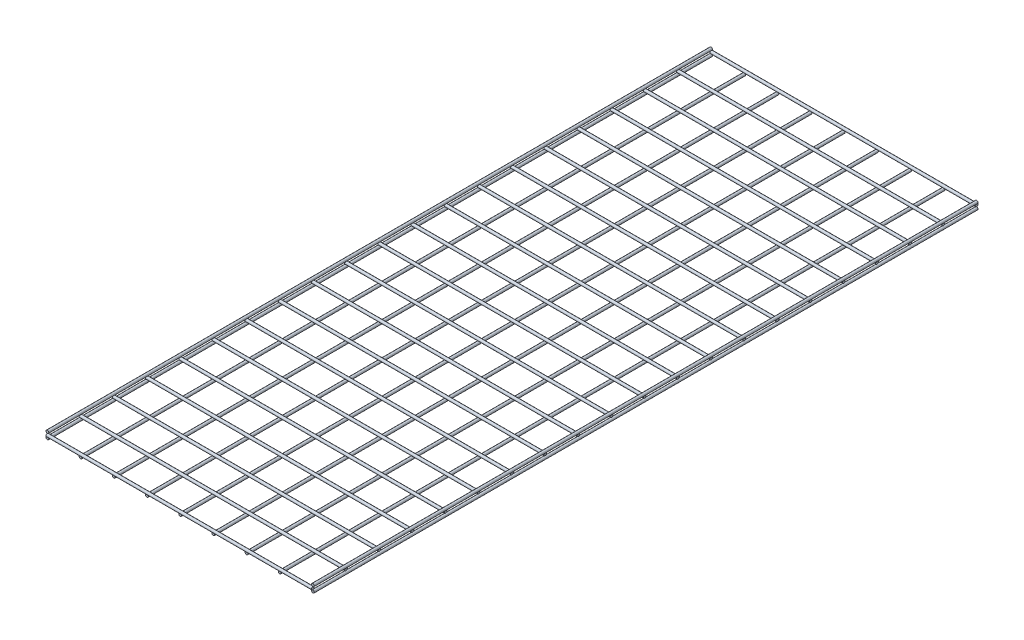
from build123d import *

# Parameters (mm, degrees)
SKETCH1_R              = 3.175
BOSS_EXTRUDE1_DEPTH    = 1524
BOSS_EXTRUDE1_2_DEPTH  = 1524
BOSS_EXTRUDE1_3_DEPTH  = 1524
BOSS_EXTRUDE1_4_DEPTH  = 1524
BOSS_EXTRUDE1_5_DEPTH  = 1524
BOSS_EXTRUDE1_6_DEPTH  = 1524
BOSS_EXTRUDE1_7_DEPTH  = 1524
BOSS_EXTRUDE1_8_DEPTH  = 1524
BOSS_EXTRUDE1_9_DEPTH  = 1524
BOSS_EXTRUDE1_10_DEPTH = 1524
BOSS_EXTRUDE1_11_DEPTH = 1524
SKETCH2_R              = 3.175
BOSS_EXTRUDE2_DEPTH    = 609.6
BOSS_EXTRUDE2_2_DEPTH  = 609.6
BOSS_EXTRUDE2_3_DEPTH  = 609.6
BOSS_EXTRUDE2_4_DEPTH  = 609.6
BOSS_EXTRUDE2_5_DEPTH  = 609.6
BOSS_EXTRUDE2_6_DEPTH  = 609.6
BOSS_EXTRUDE2_7_DEPTH  = 609.6
BOSS_EXTRUDE2_8_DEPTH  = 609.6
BOSS_EXTRUDE2_9_DEPTH  = 609.6
BOSS_EXTRUDE2_10_DEPTH = 609.6
BOSS_EXTRUDE2_11_DEPTH = 609.6
BOSS_EXTRUDE2_12_DEPTH = 609.6
BOSS_EXTRUDE2_13_DEPTH = 609.6
BOSS_EXTRUDE2_14_DEPTH = 609.6
BOSS_EXTRUDE2_15_DEPTH = 609.6
BOSS_EXTRUDE2_16_DEPTH = 609.6
BOSS_EXTRUDE2_17_DEPTH = 609.6
BOSS_EXTRUDE2_18_DEPTH = 609.6
BOSS_EXTRUDE2_19_DEPTH = 609.6
BOSS_EXTRUDE2_20_DEPTH = 609.6
BOSS_EXTRUDE2_21_DEPTH = 609.6


with BuildPart() as part:
    # Sketch1 → Boss-Extrude1 (new body)
    with BuildSketch(Plane.XY):
        Circle(SKETCH1_R)
    extrude(amount=BOSS_EXTRUDE1_DEPTH)


with BuildPart() as body_2:
    # Sketch1 → Boss-Extrude1 2 (new body)
    with BuildSketch(Plane.XY):
        with Locations((0, 12.7)):
            Circle(SKETCH1_R)
    extrude(amount=BOSS_EXTRUDE1_2_DEPTH)


with BuildPart() as body_3:
    # Sketch1 → Boss-Extrude1 3 (new body)
    with BuildSketch(Plane.XY):
        with Locations((76.2, 0)):
            Circle(SKETCH1_R)
    extrude(amount=BOSS_EXTRUDE1_3_DEPTH)


with BuildPart() as body_4:
    # Sketch1 → Boss-Extrude1 4 (new body)
    with BuildSketch(Plane.XY):
        with Locations((152.4, 0)):
            Circle(SKETCH1_R)
    extrude(amount=BOSS_EXTRUDE1_4_DEPTH)


with BuildPart() as body_5:
    # Sketch1 → Boss-Extrude1 5 (new body)
    with BuildSketch(Plane.XY):
        with Locations((228.6, 0)):
            Circle(SKETCH1_R)
    extrude(amount=BOSS_EXTRUDE1_5_DEPTH)


with BuildPart() as body_6:
    # Sketch1 → Boss-Extrude1 6 (new body)
    with BuildSketch(Plane.XY):
        with Locations((304.8, 0)):
            Circle(SKETCH1_R)
    extrude(amount=BOSS_EXTRUDE1_6_DEPTH)


with BuildPart() as body_7:
    # Sketch1 → Boss-Extrude1 7 (new body)
    with BuildSketch(Plane.XY):
        with Locations((381, 0)):
            Circle(SKETCH1_R)
    extrude(amount=BOSS_EXTRUDE1_7_DEPTH)


with BuildPart() as body_8:
    # Sketch1 → Boss-Extrude1 8 (new body)
    with BuildSketch(Plane.XY):
        with Locations((457.2, 0)):
            Circle(SKETCH1_R)
    extrude(amount=BOSS_EXTRUDE1_8_DEPTH)


with BuildPart() as body_9:
    # Sketch1 → Boss-Extrude1 9 (new body)
    with BuildSketch(Plane.XY):
        with Locations((533.4, 0)):
            Circle(SKETCH1_R)
    extrude(amount=BOSS_EXTRUDE1_9_DEPTH)


with BuildPart() as body_10:
    # Sketch1 → Boss-Extrude1 10 (new body)
    with BuildSketch(Plane.XY):
        with Locations((609.6, 0)):
            Circle(SKETCH1_R)
    extrude(amount=BOSS_EXTRUDE1_10_DEPTH)


with BuildPart() as body_11:
    # Sketch1 → Boss-Extrude1 11 (new body)
    with BuildSketch(Plane.XY):
        with Locations((609.6, 12.7)):
            Circle(SKETCH1_R)
    extrude(amount=BOSS_EXTRUDE1_11_DEPTH)


with BuildPart() as body_12:
    # Sketch2 → Boss-Extrude2 (new body)
    with BuildSketch(Plane(origin=(0, 0, 0), x_dir=(0, 0, -1), z_dir=(1, 0, 0))):
        with Locations(Location((0, 6.35, 0), (0, 0, 180))):
            Circle(SKETCH2_R)
    extrude(amount=BOSS_EXTRUDE2_DEPTH)


with BuildPart() as body_13:
    # Sketch2 → Boss-Extrude2 2 (new body)
    with BuildSketch(Plane(origin=(0, 0, 0), x_dir=(0, 0, -1), z_dir=(1, 0, 0))):
        with Locations(Location((-76.2, 6.35, 0), (0, 0, 180))):
            Circle(SKETCH2_R)
    extrude(amount=BOSS_EXTRUDE2_2_DEPTH)


with BuildPart() as body_14:
    # Sketch2 → Boss-Extrude2 3 (new body)
    with BuildSketch(Plane(origin=(0, 0, 0), x_dir=(0, 0, -1), z_dir=(1, 0, 0))):
        with Locations(Location((-152.4, 6.35, 0), (0, 0, 180))):
            Circle(SKETCH2_R)
    extrude(amount=BOSS_EXTRUDE2_3_DEPTH)


with BuildPart() as body_15:
    # Sketch2 → Boss-Extrude2 4 (new body)
    with BuildSketch(Plane(origin=(0, 0, 0), x_dir=(0, 0, -1), z_dir=(1, 0, 0))):
        with Locations(Location((-228.6, 6.35, 0), (0, 0, 180))):
            Circle(SKETCH2_R)
    extrude(amount=BOSS_EXTRUDE2_4_DEPTH)


with BuildPart() as body_16:
    # Sketch2 → Boss-Extrude2 5 (new body)
    with BuildSketch(Plane(origin=(0, 0, 0), x_dir=(0, 0, -1), z_dir=(1, 0, 0))):
        with Locations(Location((-304.8, 6.35, 0), (0, 0, 180))):
            Circle(SKETCH2_R)
    extrude(amount=BOSS_EXTRUDE2_5_DEPTH)


with BuildPart() as body_17:
    # Sketch2 → Boss-Extrude2 6 (new body)
    with BuildSketch(Plane(origin=(0, 0, 0), x_dir=(0, 0, -1), z_dir=(1, 0, 0))):
        with Locations(Location((-381, 6.35, 0), (0, 0, 180))):
            Circle(SKETCH2_R)
    extrude(amount=BOSS_EXTRUDE2_6_DEPTH)


with BuildPart() as body_18:
    # Sketch2 → Boss-Extrude2 7 (new body)
    with BuildSketch(Plane(origin=(0, 0, 0), x_dir=(0, 0, -1), z_dir=(1, 0, 0))):
        with Locations(Location((-457.2, 6.35, 0), (0, 0, 180))):
            Circle(SKETCH2_R)
    extrude(amount=BOSS_EXTRUDE2_7_DEPTH)


with BuildPart() as body_19:
    # Sketch2 → Boss-Extrude2 8 (new body)
    with BuildSketch(Plane(origin=(0, 0, 0), x_dir=(0, 0, -1), z_dir=(1, 0, 0))):
        with Locations(Location((-533.4, 6.35, 0), (0, 0, 180))):
            Circle(SKETCH2_R)
    extrude(amount=BOSS_EXTRUDE2_8_DEPTH)


with BuildPart() as body_20:
    # Sketch2 → Boss-Extrude2 9 (new body)
    with BuildSketch(Plane(origin=(0, 0, 0), x_dir=(0, 0, -1), z_dir=(1, 0, 0))):
        with Locations(Location((-609.6, 6.35, 0), (0, 0, 180))):
            Circle(SKETCH2_R)
    extrude(amount=BOSS_EXTRUDE2_9_DEPTH)


with BuildPart() as body_21:
    # Sketch2 → Boss-Extrude2 10 (new body)
    with BuildSketch(Plane(origin=(0, 0, 0), x_dir=(0, 0, -1), z_dir=(1, 0, 0))):
        with Locations(Location((-685.8, 6.35, 0), (0, 0, 180))):
            Circle(SKETCH2_R)
    extrude(amount=BOSS_EXTRUDE2_10_DEPTH)


with BuildPart() as body_22:
    # Sketch2 → Boss-Extrude2 11 (new body)
    with BuildSketch(Plane(origin=(0, 0, 0), x_dir=(0, 0, -1), z_dir=(1, 0, 0))):
        with Locations(Location((-762, 6.35, 0), (0, 0, 180))):
            Circle(SKETCH2_R)
    extrude(amount=BOSS_EXTRUDE2_11_DEPTH)


with BuildPart() as body_23:
    # Sketch2 → Boss-Extrude2 12 (new body)
    with BuildSketch(Plane(origin=(0, 0, 0), x_dir=(0, 0, -1), z_dir=(1, 0, 0))):
        with Locations(Location((-838.2, 6.35, 0), (0, 0, 180))):
            Circle(SKETCH2_R)
    extrude(amount=BOSS_EXTRUDE2_12_DEPTH)


with BuildPart() as body_24:
    # Sketch2 → Boss-Extrude2 13 (new body)
    with BuildSketch(Plane(origin=(0, 0, 0), x_dir=(0, 0, -1), z_dir=(1, 0, 0))):
        with Locations(Location((-914.4, 6.35, 0), (0, 0, 180))):
            Circle(SKETCH2_R)
    extrude(amount=BOSS_EXTRUDE2_13_DEPTH)


with BuildPart() as body_25:
    # Sketch2 → Boss-Extrude2 14 (new body)
    with BuildSketch(Plane(origin=(0, 0, 0), x_dir=(0, 0, -1), z_dir=(1, 0, 0))):
        with Locations(Location((-990.6, 6.35, 0), (0, 0, 180))):
            Circle(SKETCH2_R)
    extrude(amount=BOSS_EXTRUDE2_14_DEPTH)


with BuildPart() as body_26:
    # Sketch2 → Boss-Extrude2 15 (new body)
    with BuildSketch(Plane(origin=(0, 0, 0), x_dir=(0, 0, -1), z_dir=(1, 0, 0))):
        with Locations(Location((-1066.8, 6.35, 0), (0, 0, 180))):
            Circle(SKETCH2_R)
    extrude(amount=BOSS_EXTRUDE2_15_DEPTH)


with BuildPart() as body_27:
    # Sketch2 → Boss-Extrude2 16 (new body)
    with BuildSketch(Plane(origin=(0, 0, 0), x_dir=(0, 0, -1), z_dir=(1, 0, 0))):
        with Locations(Location((-1143, 6.35, 0), (0, 0, 180))):
            Circle(SKETCH2_R)
    extrude(amount=BOSS_EXTRUDE2_16_DEPTH)


with BuildPart() as body_28:
    # Sketch2 → Boss-Extrude2 17 (new body)
    with BuildSketch(Plane(origin=(0, 0, 0), x_dir=(0, 0, -1), z_dir=(1, 0, 0))):
        with Locations(Location((-1219.2, 6.35, 0), (0, 0, 180))):
            Circle(SKETCH2_R)
    extrude(amount=BOSS_EXTRUDE2_17_DEPTH)


with BuildPart() as body_29:
    # Sketch2 → Boss-Extrude2 18 (new body)
    with BuildSketch(Plane(origin=(0, 0, 0), x_dir=(0, 0, -1), z_dir=(1, 0, 0))):
        with Locations(Location((-1295.4, 6.35, 0), (0, 0, 180))):
            Circle(SKETCH2_R)
    extrude(amount=BOSS_EXTRUDE2_18_DEPTH)


with BuildPart() as body_30:
    # Sketch2 → Boss-Extrude2 19 (new body)
    with BuildSketch(Plane(origin=(0, 0, 0), x_dir=(0, 0, -1), z_dir=(1, 0, 0))):
        with Locations(Location((-1371.6, 6.35, 0), (0, 0, 180))):
            Circle(SKETCH2_R)
    extrude(amount=BOSS_EXTRUDE2_19_DEPTH)


with BuildPart() as body_31:
    # Sketch2 → Boss-Extrude2 20 (new body)
    with BuildSketch(Plane(origin=(0, 0, 0), x_dir=(0, 0, -1), z_dir=(1, 0, 0))):
        with Locations(Location((-1447.8, 6.35, 0), (0, 0, 180))):
            Circle(SKETCH2_R)
    extrude(amount=BOSS_EXTRUDE2_20_DEPTH)


with BuildPart() as body_32:
    # Sketch2 → Boss-Extrude2 21 (new body)
    with BuildSketch(Plane(origin=(0, 0, 0), x_dir=(0, 0, -1), z_dir=(1, 0, 0))):
        with Locations(Location((-1524, 6.35, 0), (0, 0, 180))):
            Circle(SKETCH2_R)
    extrude(amount=BOSS_EXTRUDE2_21_DEPTH)


solid = Compound([part.part, body_2.part, body_3.part, body_4.part, body_5.part, body_6.part, body_7.part, body_8.part, body_9.part, body_10.part, body_11.part, body_12.part, body_13.part, body_14.part, body_15.part, body_16.part, body_17.part, body_18.part, body_19.part, body_20.part, body_21.part, body_22.part, body_23.part, body_24.part, body_25.part, body_26.part, body_27.part, body_28.part, body_29.part, body_30.part, body_31.part, body_32.part])
